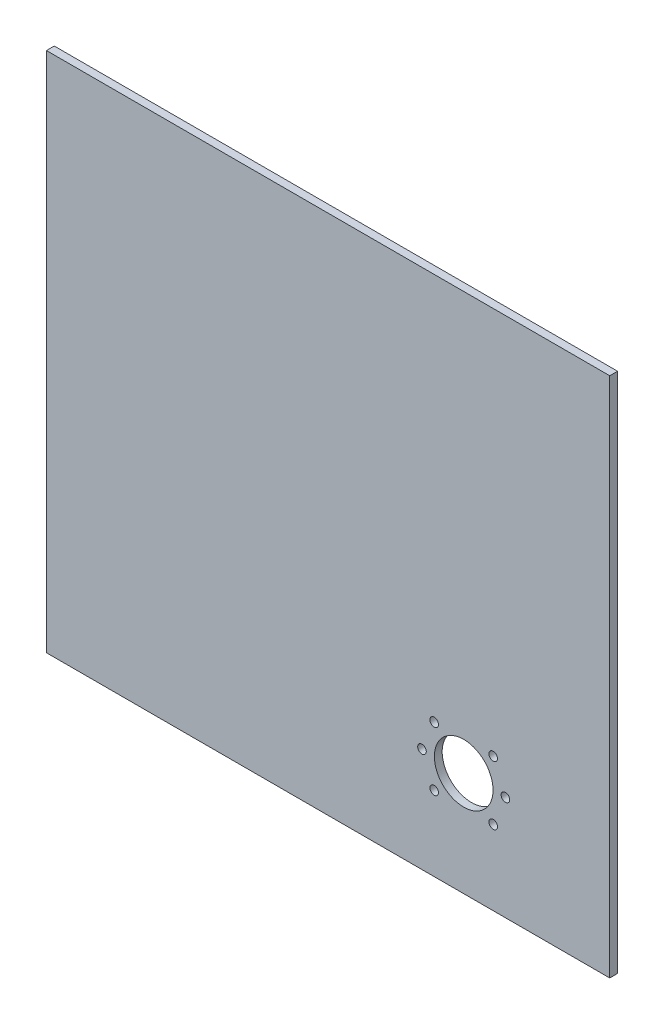
from build123d import *

# Parameters (mm, degrees)
SKETCH_1_W          = 216
SKETCH_1_H          = 200
EXTRUDE_1_DEPTH     = 3
SKETCH_2_R          = 11.25
CUT_EXTRUDE_1_DEPTH = 148.217526131
HOLE_WIZARD_M4_1_D  = 3.3


with BuildPart() as part:
    # 草图1 → 凸台-拉伸1 (new body)
    with BuildSketch(Plane.XY):
        Rectangle(SKETCH_1_W, SKETCH_1_H)
    extrude(amount=EXTRUDE_1_DEPTH)

    # 草图2 → 切除-拉伸1 (cut, through all)
    with BuildSketch(Plane.XY.offset(3)):
        with Locations((52, -60)):
            Circle(SKETCH_2_R)
    extrude(amount=-CUT_EXTRUDE_1_DEPTH, mode=Mode.SUBTRACT)

    # M4 螺纹孔的螺纹孔钻头1 (through all)
    with Locations(Plane(origin=(36, -60, 3), x_dir=(1, 0, 0), z_dir=(0, 0, 1))):
        with Locations((0, 0), (4.686291501, 11.313708499), (4.686291501, -11.313708499), (27.313708499, 11.313708499), (32, 0), (27.313708499, -11.313708499)):
            Hole(HOLE_WIZARD_M4_1_D / 2)


solid = part.part
